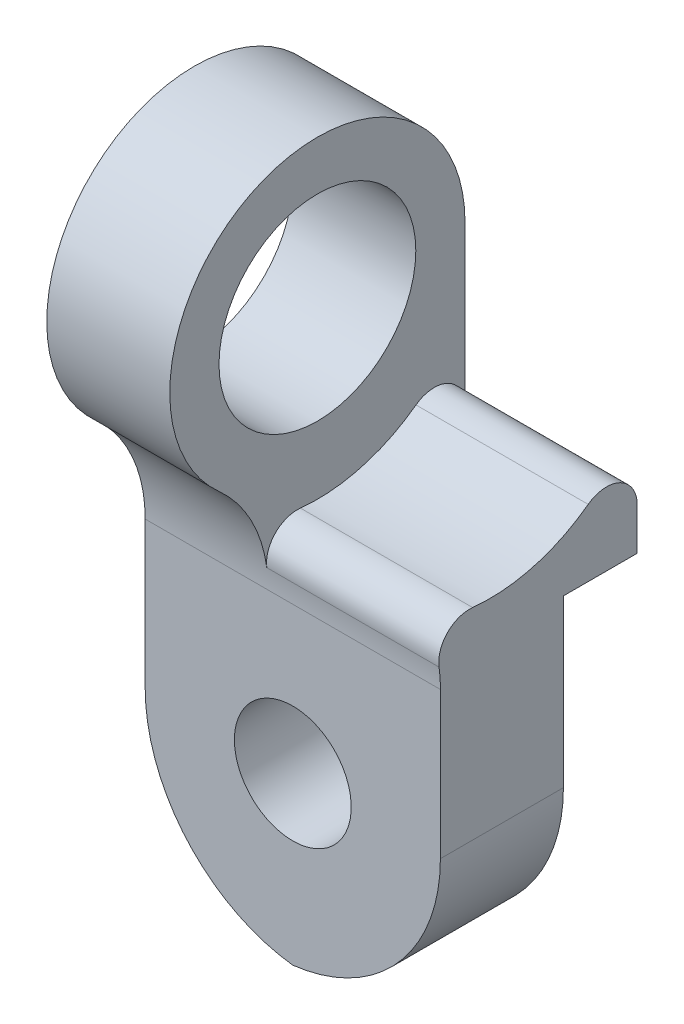
from build123d import *

# Parameters (mm, degrees)
SKETCH1_R               = 0.8
BOSS_EXTRUDE1_DEPTH     = 0.5
BOSS_EXTRUDE2_DEPTH     = 1.4
FILLET1_R               = 0.25
SKETCH3_W               = 2.4
SKETCH3_H               = 2.7
CUT_EXTRUDE1_DEPTH      = 0.6
M1_2_TAPPED_HOLE1_D     = 0.95
CUT_EXTRUDE2_DEPTH      = 6.059535711
CUT_EXTRUDE2_DEPTH_BACK = 6.059535711


with BuildPart() as part:
    # Sketch1 → Boss-Extrude1 (new, symmetric)
    with BuildSketch(Plane(origin=(0, 0, 0), x_dir=(0, 1, 0), z_dir=(-1, 0, 0))):
        with BuildLine():
            Line((-4.33, 1.2), (0, 1.2))
            ThreePointArc((0, 1.2), (1.095445115, -0.489897949), (-0.894427191, -0.8))
            ThreePointArc((-0.894427191, -0.8), (-1.298956433, -0.504554885), (-1.788854382, -0.4))
            Line((-1.788854382, -0.4), (-4.33, -0.4))
            Line((-4.33, -0.4), (-4.33, 1.2))
        make_face()
        with Locations(Location((0, 0, 0), (0, 0, 270))):
            Circle(SKETCH1_R, mode=Mode.SUBTRACT)
    extrude(amount=BOSS_EXTRUDE1_DEPTH, both=True)

    # Sketch2 → Boss-Extrude2 (add)
    with BuildSketch(Plane(origin=(0.5, 0, 0), x_dir=(0, 0, -1), z_dir=(1, 0, 0))):
        with BuildLine():
            Line((1.2, -0.618465844), (1.2, -4.33))
            Line((1.2, -4.33), (-0.4, -4.33))
            Line((-0.4, -4.33), (-0.4, -1.788854382))
            ThreePointArc((-0.4, -1.788854382), (-0.433626648, -1.506767153), (-0.532622008, -1.240489338))
            ThreePointArc((-0.532622008, -1.240489338), (0.456154198, -1.270599601), (1.2, -0.618465844))
        make_face()
    extrude(amount=BOSS_EXTRUDE2_DEPTH)

    # Fillet1
    fillet1_edges = [part.edges().sort_by_distance(p)[0] for p in [
        (1.2, -0.618465844, -1.2),
        (1.2, -1.240489338, 0.532622008),
    ]]
    fillet(fillet1_edges, radius=FILLET1_R)

    # Sketch3 → Cut-Extrude1 (cut)
    with BuildSketch(Plane(origin=(0, 0, -1.2), x_dir=(-1, 0, 0), z_dir=(0, 0, -1))):
        with Locations((-0.7, -2.98)):
            Rectangle(SKETCH3_W, SKETCH3_H)
    extrude(amount=-CUT_EXTRUDE1_DEPTH, mode=Mode.SUBTRACT)

    # M1.2 Tapped Hole1 (through all)
    with Locations(Plane(origin=(0, 0, -0.6), x_dir=(-1, 0, 0), z_dir=(0, 0, -1))):
        with Locations((-0.7, -2.98)):
            Hole(M1_2_TAPPED_HOLE1_D / 2)

    # Sketch6 → Cut-Extrude2 (cut, two sides: drawn at the far end of the back side and taken through both)
    with BuildSketch(Plane(origin=(0, 0, -0.6), x_dir=(-1, 0, 0), z_dir=(0, 0, -1)).offset(-CUT_EXTRUDE2_DEPTH_BACK)):
        with BuildLine():
            ThreePointArc((-0.7, -4.33), (-1.556634543, -3.883119593), (-1.9, -2.98))
            Line((-1.9, -2.98), (-1.9, -4.33))
            Line((-1.9, -4.33), (-0.7, -4.33))
        make_face()
        with BuildLine():
            ThreePointArc((0.5, -2.98), (0.156634543, -3.883119593), (-0.7, -4.33))
            Line((-0.7, -4.33), (0.5, -4.33))
            Line((0.5, -4.33), (0.5, -2.98))
        make_face()
    extrude(amount=CUT_EXTRUDE2_DEPTH + CUT_EXTRUDE2_DEPTH_BACK, mode=Mode.SUBTRACT)


solid = part.part
